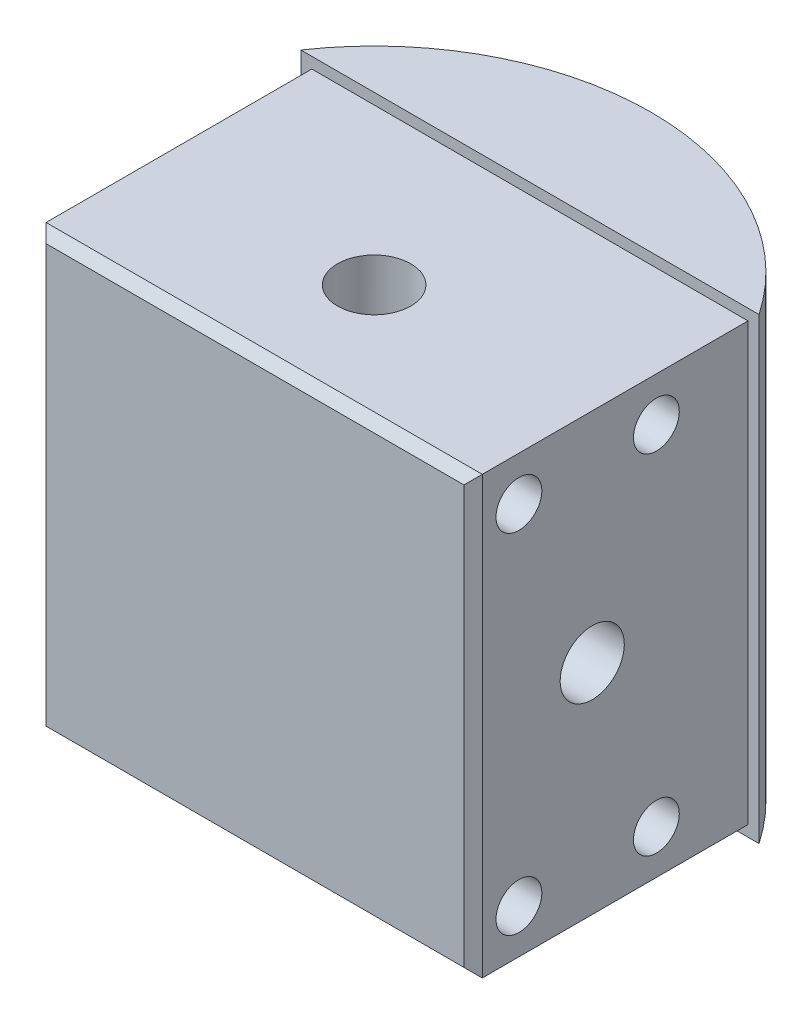
from build123d import *

# Parameters (mm, degrees)
CROQUIS1_W                   = 47.6
CROQUIS1_H                   = 47.6
SALIENTE_EXTRUIR1_DEPTH      = 30
SALIENTE_EXTRUIR2_DEPTH      = 25
SALIENTE_EXTRUIR2_DEPTH_BACK = 25
CROQUIS3_R                   = 4
CORTAR_EXTRUIR1_DEPTH        = 63.501519982
CROQUIS4_R                   = 2.5
CROQUIS4_R_2                 = 3.5
CORTAR_EXTRUIR2_DEPTH        = 63.501519982
CHAFL_N1_SIZE                = 1


with BuildPart() as part:
    # Croquis1 → Saliente-Extruir1 (new body)
    with BuildSketch(Plane.XY):
        Rectangle(CROQUIS1_W, CROQUIS1_H)
    extrude(amount=SALIENTE_EXTRUIR1_DEPTH)

    # Croquis2 → Saliente-Extruir2 (add, two sides: drawn at the far end of the back side and taken through both)
    with BuildSketch(Plane(origin=(0, 0, 0), x_dir=(1, 0, 0), z_dir=(0, 1, 0)).offset(-SALIENTE_EXTRUIR2_DEPTH_BACK)):
        with BuildLine():
            Line((-25, 0), (25, 0))
            ThreePointArc((25, 0), (0, 13.232432916), (-25, 0))
        make_face()
    extrude(amount=SALIENTE_EXTRUIR2_DEPTH + SALIENTE_EXTRUIR2_DEPTH_BACK)

    # Croquis3 → Cortar-Extruir1 (cut, through all)
    with BuildSketch(Plane(origin=(0, 23.8, 0), x_dir=(1, 0, 0), z_dir=(0, 1, 0))):
        with Locations(Location((0, -17, 0), (0, 0, 270))):
            Circle(CROQUIS3_R)
    extrude(amount=-CORTAR_EXTRUIR1_DEPTH, mode=Mode.SUBTRACT)

    # Croquis4 → Cortar-Extruir2 (cut, through all)
    with BuildSketch(Plane(origin=(23.8, 0, 0), x_dir=(0, 0, -1), z_dir=(1, 0, 0))):
        with Locations(Location((-10, 19, 0), (0, 0, 90))):
            Circle(CROQUIS4_R)
        with Locations(Location((-25, 19, 0), (0, 0, 90))):
            Circle(CROQUIS4_R)
        with Locations(Location((-25, -19, 0), (0, 0, 90))):
            Circle(CROQUIS4_R)
        with Locations(Location((-10, -19, 0), (0, 0, 90))):
            Circle(CROQUIS4_R)
        with Locations(Location((-17, 0, 0), (0, 0, 90))):
            Circle(CROQUIS4_R_2)
    extrude(amount=-CORTAR_EXTRUIR2_DEPTH, mode=Mode.SUBTRACT)

    # Chaflán1
    chafl_n1_edges = [part.edges().sort_by_distance(p)[0] for p in [
        (-23.8, 0, 30),
        (0, -23.8, 30),
        (23.8, 0, 30),
        (0, 23.8, 30),
    ]]
    chamfer(chafl_n1_edges, length=CHAFL_N1_SIZE)


solid = part.part
